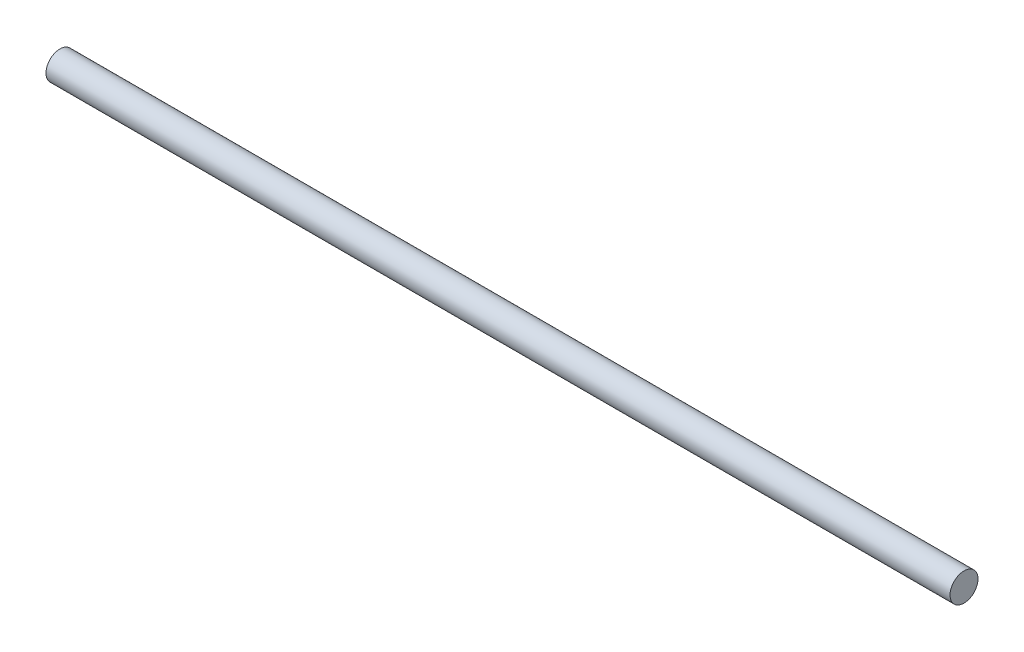
from build123d import *

# Parameters (mm, degrees)
SKETCH1_R           = 1.5
BOSS_EXTRUDE1_DEPTH = 97


with BuildPart() as part:
    # Sketch1 → Boss-Extrude1 (new body)
    with BuildSketch(Plane(origin=(0, 0, 0), x_dir=(0, 0, -1), z_dir=(1, 0, 0))):
        Circle(SKETCH1_R)
    extrude(amount=BOSS_EXTRUDE1_DEPTH)


solid = part.part
